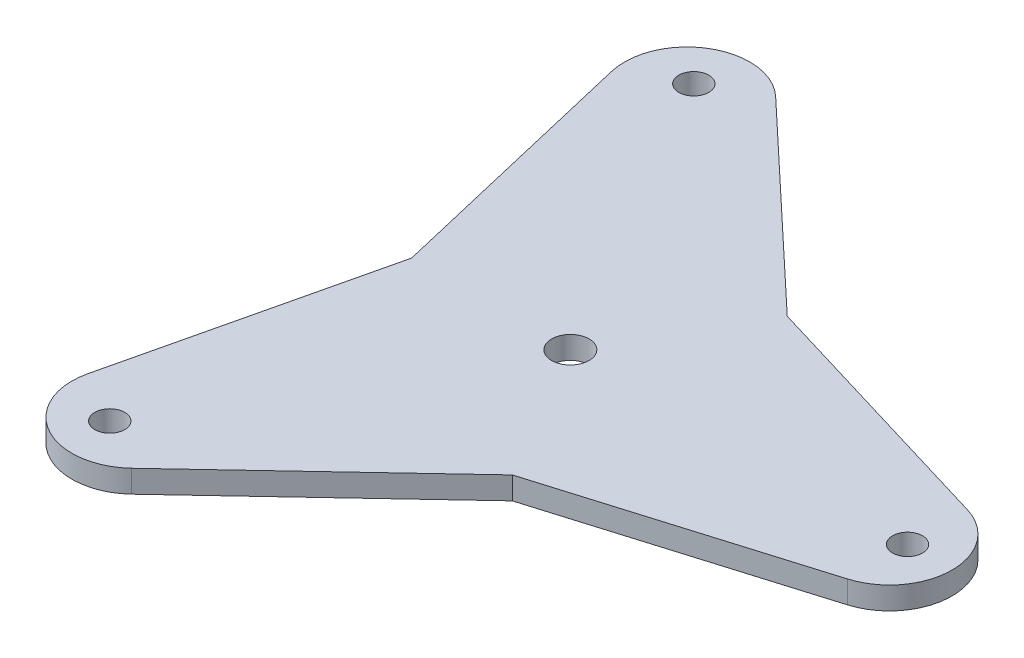
from build123d import *

# Parameters (mm, degrees)
SKETCH2_R           = 2.5
SKETCH2_R_2         = 2
BOSS_EXTRUDE2_DEPTH = 3


with BuildPart() as part:
    # Sketch2 → Boss-Extrude2 (new body)
    with BuildSketch(Plane(origin=(0, 0, 0), x_dir=(1, 0, 0), z_dir=(0, 1, 0))):
        with BuildLine():
            Line((10.594452967, -18.350130817), (45, -8))
            ThreePointArc((45, -8), (50.947530499, 0), (45, 8))
            Line((45, 8), (10.594452967, 18.350130817))
            Line((10.594452967, 18.350130817), (-15.57179677, 42.97114317))
            ThreePointArc((-15.57179677, 42.97114317), (-25.473765249, 44.121855672), (-29.42820323, 34.97114317))
            Line((-29.42820323, 34.97114317), (-21.188905934, 0))
            Line((-21.188905934, 0), (-29.42820323, -34.97114317))
            ThreePointArc((-29.42820323, -34.97114317), (-25.473765249, -44.121855672), (-15.57179677, -42.97114317))
            Line((-15.57179677, -42.97114317), (10.594452967, -18.350130817))
        make_face()
        with Locations(Location((0, 0, 0), (0, 0, 270))):
            Circle(SKETCH2_R, mode=Mode.SUBTRACT)
        with Locations(Location((-22.50172491, 38.974130802, 0), (0, 0, 270))):
            Circle(SKETCH2_R_2, mode=Mode.SUBTRACT)
        with Locations(Location((45.00344982, 0, 0), (0, 0, 270))):
            Circle(SKETCH2_R_2, mode=Mode.SUBTRACT)
        with Locations(Location((-22.50172491, -38.974130802, 0), (0, 0, 270))):
            Circle(SKETCH2_R_2, mode=Mode.SUBTRACT)
    extrude(amount=BOSS_EXTRUDE2_DEPTH)


solid = part.part
